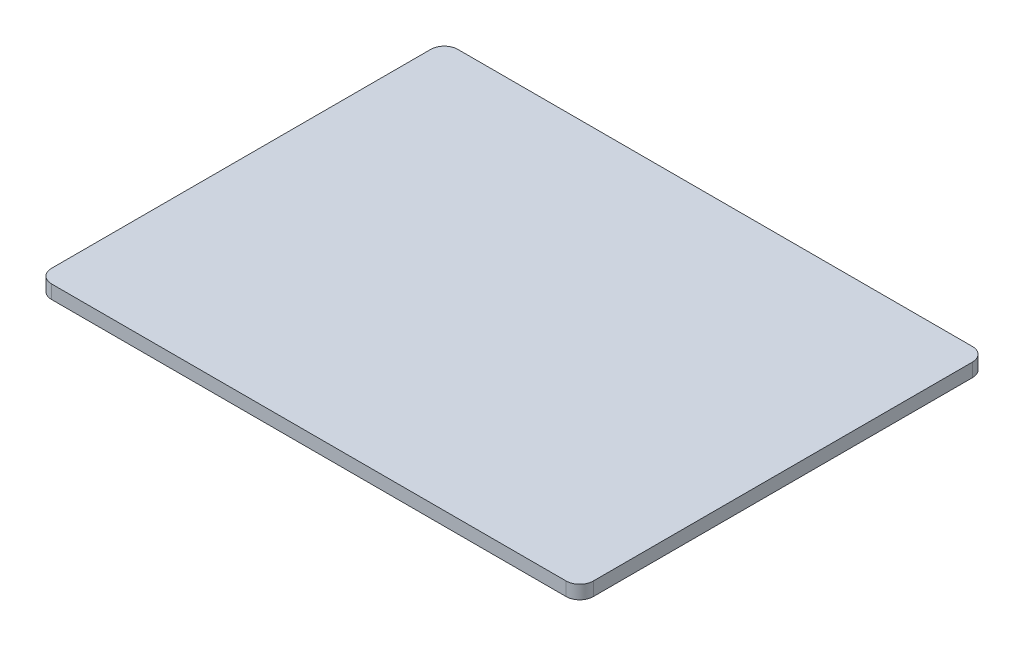
from build123d import *

# Parameters (mm, degrees)
SKETCH1_W           = 400
SKETCH1_H           = 300
BOSS_EXTRUDE1_DEPTH = 10
FILLET1_R           = 10


with BuildPart() as part:
    # Sketch1 → Boss-Extrude1 (new body)
    with BuildSketch(Plane(origin=(0, 0, 0), x_dir=(1, 0, 0), z_dir=(0, 1, 0))):
        with Locations((200, 150)):
            Rectangle(SKETCH1_W, SKETCH1_H)
    extrude(amount=BOSS_EXTRUDE1_DEPTH)

    # Fillet1
    fillet1_edges = [part.edges().sort_by_distance(p)[0] for p in [
        (0, 5, -300),
        (400, 5, -300),
        (400, 5, 0),
        (0, 5, 0),
    ]]
    fillet(fillet1_edges, radius=FILLET1_R)


solid = part.part
